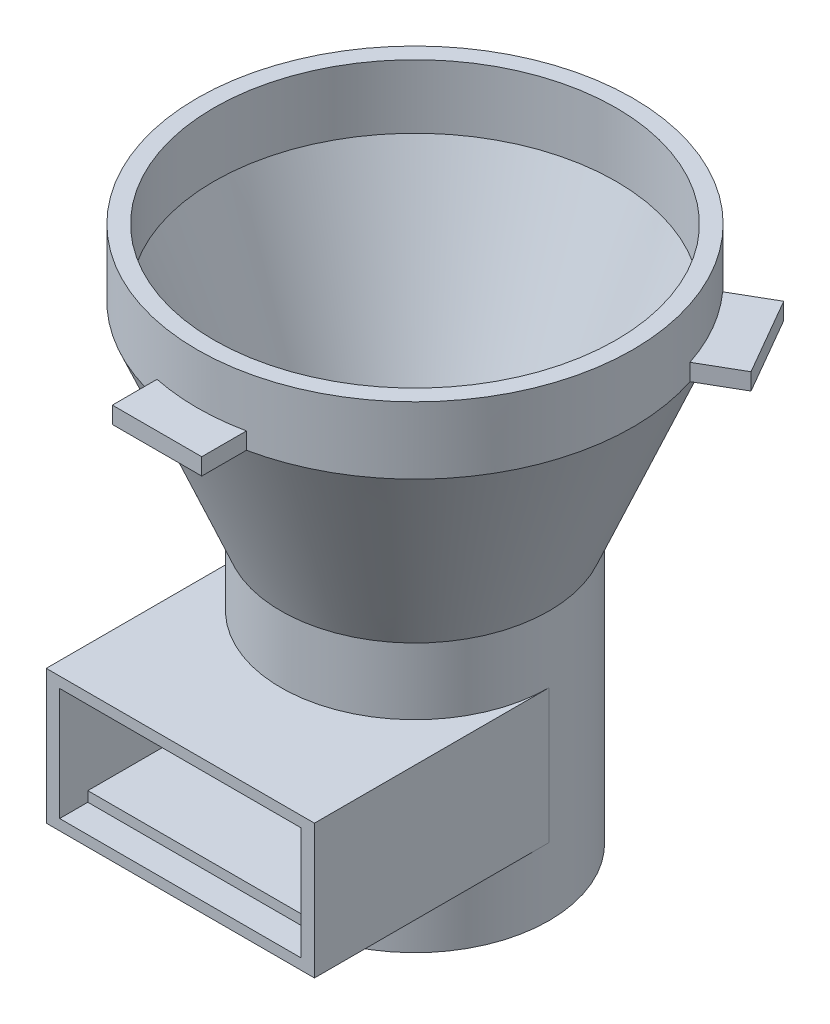
from build123d import *
from build123d.topology import SkipClean

# Parameters (mm, degrees)
SHELL1_T                = -3.175
BOSS_EXTRUDE1_START     = -3.175
BOSS_EXTRUDE1_DEPTH     = 3.175
CIRPATTERN1_COUNT       = 3
SKETCH4_W               = 50.8
SKETCH4_H               = 25.4
BOSS_EXTRUDE2_DEPTH     = 44.45
CUT_EXTRUDE1_DEPTH      = 87.342151299
CUT_EXTRUDE1_DEPTH_BACK = 87.342151299
SKETCH5_R               = 22.225
SKETCH6_W               = 45.72
SKETCH6_H               = 21.336
CUT_EXTRUDE2_DEPTH      = 40.767
BOSS_EXTRUDE3_DEPTH     = 1.905
SKETCH8_W               = 45.72
SKETCH8_H               = 1.905
BOSS_EXTRUDE4_DEPTH     = 16.256
SKETCH10_R              = 41.275
SKETCH10_R_2            = 38.1
BOSS_EXTRUDE5_DEPTH     = 9.525


with BuildPart() as part:
    # Sketch1 → Revolve1 (revolve)
    with BuildSketch(Plane.XY, mode=Mode.PRIVATE) as revolve1_sk:
        Polygon((0, 92.075), (-41.275, 92.075), (-41.275, 88.9), (-25.4, 50.8), (-25.4, 0), (0, 0), align=None)
    revolve(revolve1_sk.sketch.rotate(Axis((0, 0, 0), (0, 1, 0)), 180), axis=Axis((0, 0, 0), (0, 1, 0)))

    # Shell1
    shell1_openings = [part.faces().sort_by_distance(p)[0] for p in [
        (0, 0, 0),
        (0, 92.075, 0),
    ]]
    offset(amount=SHELL1_T, openings=shell1_openings, kind=Kind.INTERSECTION)

    # Sketch2 → Boss-Extrude1 (add)
    with BuildSketch(Plane(origin=(0, 92.075, 0), x_dir=(1, 0, 0), z_dir=(0, 1, 0)).offset(BOSS_EXTRUDE1_START)):
        with BuildLine():
            Line((0, -48.863958414), (-8.466666667, -48.863958414))
            Line((-8.466666667, -48.863958414), (-8.466666667, -40.397291748))
            ThreePointArc((-8.466666667, -40.397291748), (0, -41.275), (8.466666667, -40.397291748))
            Line((8.466666667, -40.397291748), (8.466666667, -48.863958414))
            Line((8.466666667, -48.863958414), (0, -48.863958414))
        make_face()
    boss_extrude1 = extrude(amount=BOSS_EXTRUDE1_DEPTH)

    # CirPattern1: Boss-Extrude1 ×3 about axis
    cirpattern1_axis = Axis((0, 0, 0), (0, 1, 0))
    for i in range(1, CIRPATTERN1_COUNT):
        add(boss_extrude1.rotate(cirpattern1_axis, i * 360 / CIRPATTERN1_COUNT))

    # Sketch4 → Boss-Extrude2 (add)
    with BuildSketch(Plane.XY):
        with Locations((0, 25.520500134)):
            Rectangle(SKETCH4_W, SKETCH4_H)
    extrude(amount=BOSS_EXTRUDE2_DEPTH)

    # Sketch5 → Cut-Extrude1 (cut, two sides: drawn at the far end of the back side and taken through both)
    with BuildSketch(Plane(origin=(0, 38.220500134, 0), x_dir=(1, 0, 0), z_dir=(0, 1, 0)).offset(-CUT_EXTRUDE1_DEPTH_BACK)):
        with Locations(Location((0, 0, 0), (0, 0, 180))):
            Circle(SKETCH5_R)
    extrude(amount=CUT_EXTRUDE1_DEPTH + CUT_EXTRUDE1_DEPTH_BACK, mode=Mode.SUBTRACT)

    # Sketch6 → Cut-Extrude2 (cut)
    with BuildSketch(Plane.XY.offset(44.45)):
        with Locations((0, 25.520500134)):
            Rectangle(SKETCH6_W, SKETCH6_H)
    extrude(amount=-CUT_EXTRUDE2_DEPTH, mode=Mode.SUBTRACT)

    # Sketch7 → Boss-Extrude3 (add)
    with SkipClean():  # the faces are left unmerged after this step: merging them gives an invalid solid
        with BuildSketch(Plane(origin=(0, 14.852500134, 0), x_dir=(1, 0, 0), z_dir=(0, 1, 0))):
            with BuildLine():
                Line((0, -22.860352775), (-22.86, -22.860352775))
                Line((-22.86, -22.860352775), (-22.860352775, 0))
                Line((-22.860352775, 0), (-22.225, 0))
                ThreePointArc((-22.225, 0), (-1.847898428, -22.148044979), (21.917712837, -3.683))
                Line((21.917712837, -3.683), (22.86, -3.683))
                Line((22.86, -3.683), (22.860352775, 0))
                Line((22.860352775, 0), (22.86, -22.860352775))
                Line((22.86, -22.860352775), (0, -22.860352775))
            make_face()
        extrude(amount=BOSS_EXTRUDE3_DEPTH)

    # Sketch8 → Boss-Extrude4 (add)
    with SkipClean():  # the faces are left unmerged after this step: merging them gives an invalid solid
        with BuildSketch(Plane.XY.offset(22.860352775)):
            with Locations((0, 15.805000134)):
                Rectangle(SKETCH8_W, SKETCH8_H)
        extrude(amount=BOSS_EXTRUDE4_DEPTH)

    # Sketch10 → Boss-Extrude5 (add)
    with BuildSketch(Plane(origin=(0, 92.075, 0), x_dir=(1, 0, 0), z_dir=(0, 1, 0))):
        with Locations(Location((0, 0, 0), (0, 0, 18.162995844))):
            Circle(SKETCH10_R)
        with Locations(Location((0, 0, 0), (0, 0, 180))):
            Circle(SKETCH10_R_2, mode=Mode.SUBTRACT)
    extrude(amount=BOSS_EXTRUDE5_DEPTH)


solid = part.part
